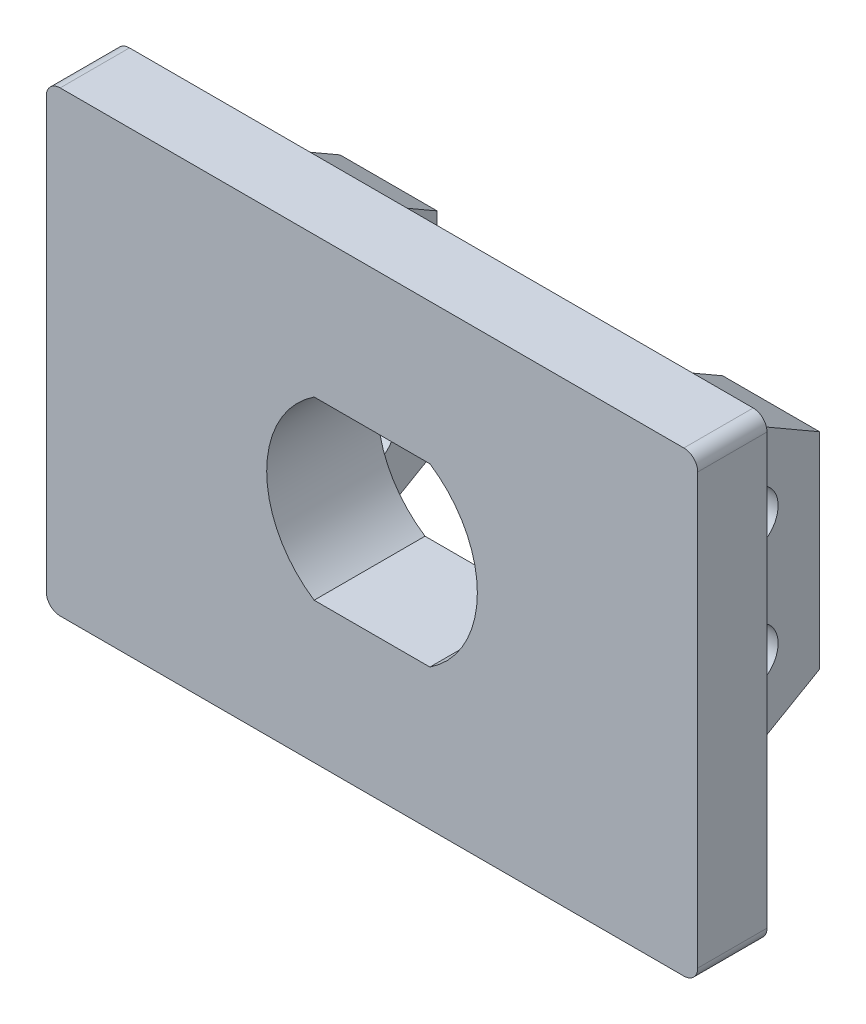
from build123d import *
from OCP.BRepFilletAPI import BRepFilletAPI_MakeChamfer

# Parameters (mm, degrees)
SZKIC1_W                    = 47
SZKIC1_H                    = 33
SZKIC1_R                    = 7.6
DODANIE_WYCI_GNI_CIE1_DEPTH = 5
SZKIC2_W                    = 7
SZKIC2_H                    = 20.6
DODANIE_WYCI_GNI_CIE2_DEPTH = 10
SFAZOWANIE1_SIZE            = 5
SFAZOWANIE1_SIZE2           = 2.886751346
SZKIC3_R                    = 2
WYTNIJ_WYCI_GNI_CIE1_DEPTH  = 46.131917752
ZAOKR_GLENIE1_R             = 1
DODANIE_WYCI_GNI_CIE4_START = 3
SZKIC5_W                    = 20.6
SZKIC5_H                    = 20.6
DODANIE_WYCI_GNI_CIE4_DEPTH = 3


with BuildPart() as part:
    # Szkic1 → Dodanie-wyciągnięcie1 (new body)
    # profile 1 of 3: a face of its own
    with BuildSketch(Plane.XY):
        Rectangle(SZKIC1_W, SZKIC1_H)
        Circle(SZKIC1_R, mode=Mode.SUBTRACT)
    # profile 2 of 3: a face of its own
    with BuildSketch(Plane.XY):
        with BuildLine():
            Line((4.175823272, -6.35), (-4.175823272, -6.35))
            ThreePointArc((-4.175823272, -6.35), (0, -7.6), (4.175823272, -6.35))
        make_face()
    # profile 3 of 3: a face of its own
    with BuildSketch(Plane.XY):
        with BuildLine():
            ThreePointArc((4.175823272, 6.35), (0, 7.6), (-4.175823272, 6.35))
            Line((-4.175823272, 6.35), (4.175823272, 6.35))
        make_face()
    extrude(amount=DODANIE_WYCI_GNI_CIE1_DEPTH)

    # Szkic2 → Dodanie-wyciągnięcie2 (add)
    with BuildSketch(Plane(origin=(0, 0, 0), x_dir=(-1, 0, 0), z_dir=(0, 0, -1))):
        with Locations((-13.8, 0)):
            Rectangle(SZKIC2_W, SZKIC2_H)
        with Locations((13.8, 0)):
            Rectangle(SZKIC2_W, SZKIC2_H)
    extrude(amount=DODANIE_WYCI_GNI_CIE2_DEPTH)

    # Sfazowanie1: one chamfer whose edges measure the first distance from different faces: ONE call of the kernel's chamfer builder (chamfer() names one face for all edges)
    sfazowanie1_edges_1 = [part.edges().sort_by_distance(p)[0] for p in [
        (13.8, 10.3, -10),
    ]]
    sfazowanie1_side_1 = [part.faces().sort_by_distance(p)[0] for p in [
        (13.8, 10.3, -5),
    ]]
    sfazowanie1_edges_2 = [part.edges().sort_by_distance(p)[0] for p in [
        (13.8, -10.3, -10),
    ]]
    sfazowanie1_side_2 = [part.faces().sort_by_distance(p)[0] for p in [
        (13.8, -10.3, -5),
    ]]
    sfazowanie1_edges_3 = [part.edges().sort_by_distance(p)[0] for p in [
        (-13.8, 10.3, -10),
    ]]
    sfazowanie1_side_3 = [part.faces().sort_by_distance(p)[0] for p in [
        (-13.8, 10.3, -5),
    ]]
    sfazowanie1_edges_4 = [part.edges().sort_by_distance(p)[0] for p in [
        (-13.8, -10.3, -10),
    ]]
    sfazowanie1_side_4 = [part.faces().sort_by_distance(p)[0] for p in [
        (-13.8, -10.3, -5),
    ]]
    sfazowanie1 = BRepFilletAPI_MakeChamfer(part.part.solid().wrapped)
    for e in sfazowanie1_edges_1:
        sfazowanie1.Add(SFAZOWANIE1_SIZE, SFAZOWANIE1_SIZE2, e.wrapped, sfazowanie1_side_1[0].wrapped)  # the first distance lies on this face
    for e in sfazowanie1_edges_2:
        sfazowanie1.Add(SFAZOWANIE1_SIZE, SFAZOWANIE1_SIZE2, e.wrapped, sfazowanie1_side_2[0].wrapped)  # the first distance lies on this face
    for e in sfazowanie1_edges_3:
        sfazowanie1.Add(SFAZOWANIE1_SIZE, SFAZOWANIE1_SIZE2, e.wrapped, sfazowanie1_side_3[0].wrapped)  # the first distance lies on this face
    for e in sfazowanie1_edges_4:
        sfazowanie1.Add(SFAZOWANIE1_SIZE, SFAZOWANIE1_SIZE2, e.wrapped, sfazowanie1_side_4[0].wrapped)  # the first distance lies on this face
    add(Compound.cast(sfazowanie1.Shape()), mode=Mode.REPLACE)

    # Szkic3 → Wytnij-wyciągnięcie1 (cut, through all)
    with BuildSketch(Plane(origin=(17.3, 0, 0), x_dir=(0, 0, -1), z_dir=(1, 0, 0))):
        with Locations((5, 4.3)):
            Circle(SZKIC3_R)
        with Locations((5, -4.3)):
            Circle(SZKIC3_R)
    extrude(amount=-WYTNIJ_WYCI_GNI_CIE1_DEPTH, mode=Mode.SUBTRACT)

    # Zaokrąglenie1
    zaokr_glenie1_edges = [part.edges().sort_by_distance(p)[0] for p in [
        (-23.5, -16.5, 2.5),
        (-23.5, 16.5, 2.5),
        (23.5, 16.5, 2.5),
        (23.5, -16.5, 2.5),
    ]]
    fillet(zaokr_glenie1_edges, radius=ZAOKR_GLENIE1_R)

    # Szkic5 → Dodanie-wyciągnięcie4 (add)
    with BuildSketch(Plane(origin=(0, 0, 0), x_dir=(-1, 0, 0), z_dir=(0, 0, -1)).offset(DODANIE_WYCI_GNI_CIE4_START)):
        Rectangle(SZKIC5_W, SZKIC5_H)
        with BuildLine():
            Line((4.175823272, -6.35), (-4.175823272, -6.35))
            ThreePointArc((-4.175823272, -6.35), (-7.6, 0), (-4.175823272, 6.35))
            Line((-4.175823272, 6.35), (4.175823272, 6.35))
            ThreePointArc((4.175823272, 6.35), (7.6, 0), (4.175823272, -6.35))
        make_face(mode=Mode.SUBTRACT)
    extrude(amount=-DODANIE_WYCI_GNI_CIE4_DEPTH)


solid = part.part
